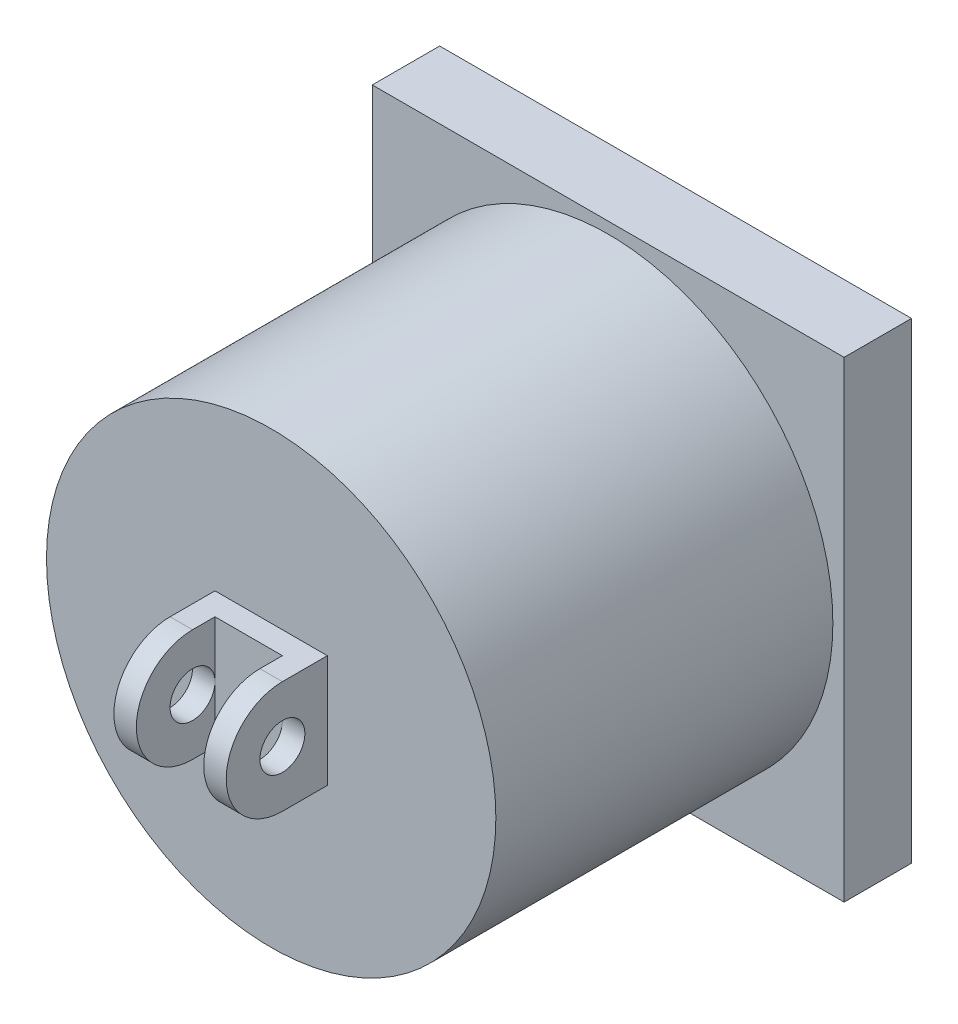
from build123d import *

# Parameters (mm, degrees)
SKETCH1_R           = 10
BOSS_EXTRUDE1_DEPTH = 15
SKETCH2_W           = 21
SKETCH2_H           = 21
BOSS_EXTRUDE2_DEPTH = 3
SKETCH3_R           = 1
BOSS_EXTRUDE3_DEPTH = 2.5
SKETCH4_W           = 3
SKETCH4_H           = 5
CUT_EXTRUDE1_DEPTH  = 3.5


with BuildPart() as part:
    # Sketch1 → Boss-Extrude1 (new body)
    with BuildSketch(Plane.XY):
        Circle(SKETCH1_R)
    extrude(amount=BOSS_EXTRUDE1_DEPTH)

    # Sketch2 → Boss-Extrude2 (add)
    with BuildSketch(Plane(origin=(0, 0, 0), x_dir=(-1, 0, 0), z_dir=(0, 0, -1))):
        Rectangle(SKETCH2_W, SKETCH2_H)
    extrude(amount=BOSS_EXTRUDE2_DEPTH)

    # Sketch3 → Boss-Extrude3 (add, symmetric)
    with BuildSketch(Plane(origin=(0, 0, 0), x_dir=(0, 0, -1), z_dir=(1, 0, 0))):
        with BuildLine():
            Line((-15, 2.5), (-15, -2.5))
            Line((-15, -2.5), (-17, -2.5))
            ThreePointArc((-17, -2.5), (-19.5, 0), (-17, 2.5))
            Line((-17, 2.5), (-15, 2.5))
        make_face()
        with Locations((-17, 0)):
            Circle(SKETCH3_R, mode=Mode.SUBTRACT)
    extrude(amount=BOSS_EXTRUDE3_DEPTH, both=True)

    # Sketch4 → Cut-Extrude1 (cut)
    with BuildSketch(Plane.XY.offset(19.5)):
        Rectangle(SKETCH4_W, SKETCH4_H)
    extrude(amount=-CUT_EXTRUDE1_DEPTH, mode=Mode.SUBTRACT)


solid = part.part
